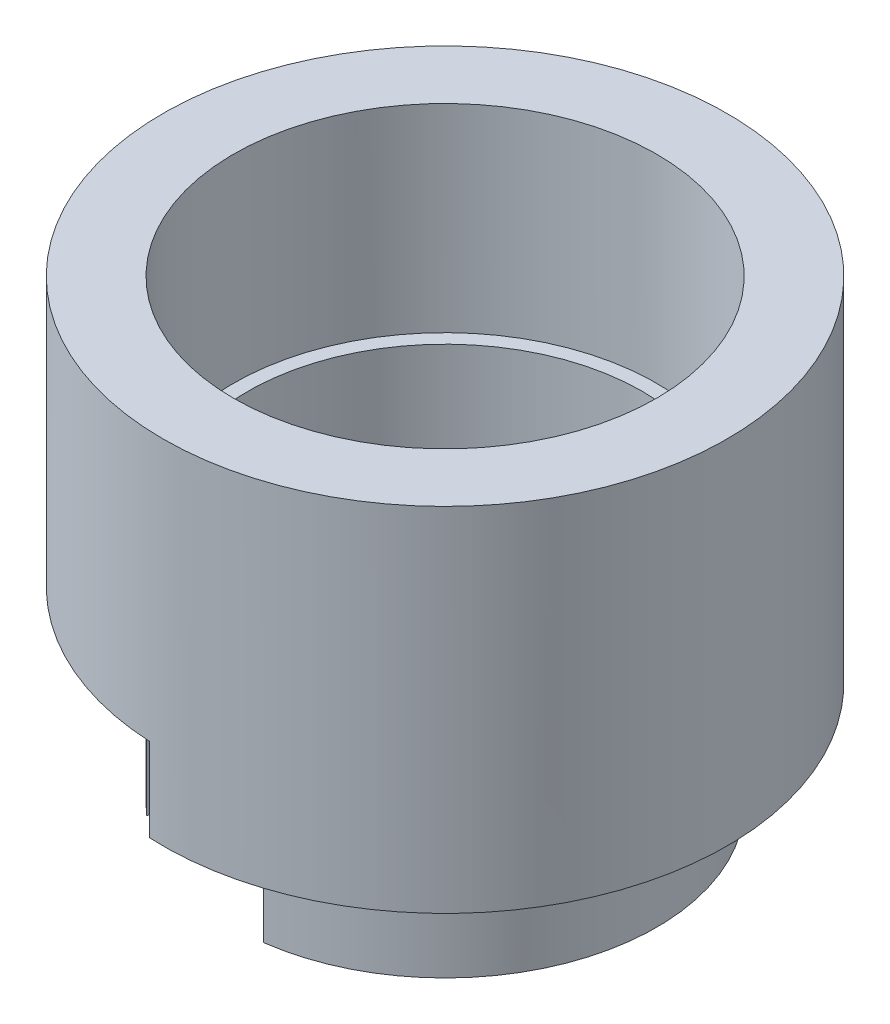
from build123d import *

# Parameters (mm, degrees)
ESBO_O1_R                     = 40
ESBO_O1_R_2                   = 30
RESSALTO_EXTRUS_O1_DEPTH      = 50
ESBO_O2_R                     = 1.5
CORTE_EXTRUS_O1_DEPTH         = 10
CORTE_EXTRUS_O2_DEPTH         = 11.84997677
RESSALTO_EXTRUS_O2_DEPTH      = 26.84997677
RESSALTO_EXTRUS_O2_DEPTH_BACK = 10
ESCALA1_SCALE                 = 0.681818182


with BuildPart() as part:
    # Esboço1 → Ressalto-extrusão1 (new body)
    with BuildSketch(Plane(origin=(0, 0, 0), x_dir=(1, 0, 0), z_dir=(0, 1, 0))):
        with Locations(Location((0, 0, 0), (0, 0, 270))):
            Circle(ESBO_O1_R)
        with Locations(Location((0, 0, 0), (0, 0, 270))):
            Circle(ESBO_O1_R_2, mode=Mode.SUBTRACT)
    extrude(amount=RESSALTO_EXTRUS_O1_DEPTH)

    # Esboço2 → Corte-extrusão1 (cut)
    with BuildSketch(Plane(origin=(0, 0, 0), x_dir=(-1, 0, 0), z_dir=(0, -1, 0))):
        with Locations(Location((-21.160269083, -29.124611797, 0), (0, 0, 90))):
            Circle(ESBO_O2_R)
        with Locations(Location((-34.238034587, -11.124611797, 0), (0, 0, 90))):
            Circle(ESBO_O2_R)
        with Locations(Location((-34.238034587, 11.124611797, 0), (0, 0, 90))):
            Circle(ESBO_O2_R)
        with Locations(Location((21.160269083, 29.124611797, 0), (0, 0, 90))):
            Circle(ESBO_O2_R)
        with Locations(Location((34.238034587, 11.124611797, 0), (0, 0, 90))):
            Circle(ESBO_O2_R)
        with Locations(Location((34.238034587, -11.124611797, 0), (0, 0, 90))):
            Circle(ESBO_O2_R)
    extrude(amount=-CORTE_EXTRUS_O1_DEPTH, mode=Mode.SUBTRACT)

    # Esboço3 → Corte-extrusão2 (cut)
    with BuildSketch(Plane(origin=(0, 0, 0), x_dir=(-1, 0, 0), z_dir=(0, -1, 0))):
        with BuildLine():
            ThreePointArc((30.293924668, -13.087327008), (31.253408489, 10.593604572), (16.092357529, 28.81034587))
            Line((16.092357529, 28.81034587), (19.505887914, 34.921631358))
            ThreePointArc((19.505887914, 34.921631358), (8.030354378, 39.185627576), (-4.197370073, 39.779166463))
            Line((-4.197370073, 39.779166463), (-3.148027555, 29.834374847))
            ThreePointArc((-3.148027555, 29.834374847), (29.911212101, 2.306380417), (1.462902849, -29.964310692))
            Line((1.462902849, -29.964310692), (1.950537132, -39.952414256))
            ThreePointArc((1.950537132, -39.952414256), (22.185986252, -33.283359416), (36.126859334, -17.171197823))
            Line((36.126859334, -17.171197823), (30.293924668, -13.087327008))
        make_face()
    extrude(amount=-CORTE_EXTRUS_O2_DEPTH, mode=Mode.SUBTRACT)

    # Esboço4 → Ressalto-extrusão2 (add, two sides: drawn at the far end of the back side and taken through both)
    with BuildSketch(Plane(origin=(0, 11.84997677, 0), x_dir=(-1, 0, 0), z_dir=(0, -1, 0)).offset(-RESSALTO_EXTRUS_O2_DEPTH_BACK)):
        with BuildLine():
            Line((-4.008838629, -29.730947056), (-4.700362463, -27.602655537))
            ThreePointArc((-4.700362463, -27.602655537), (-8.119302432, 26.79695744), (19.230258499, -20.351834268))
            Line((19.230258499, -20.351834268), (19.909240802, -22.441526924))
            ThreePointArc((19.909240802, -22.441526924), (-8.745833796, 28.696870757), (-4.008838629, -29.730947056))
        make_face()
    extrude(amount=RESSALTO_EXTRUS_O2_DEPTH + RESSALTO_EXTRUS_O2_DEPTH_BACK)


with BuildPart() as part_1:
    # Escala1: scaled about (0, 0, 0)
    add(part.part.scale(ESCALA1_SCALE))


solid = part_1.part
